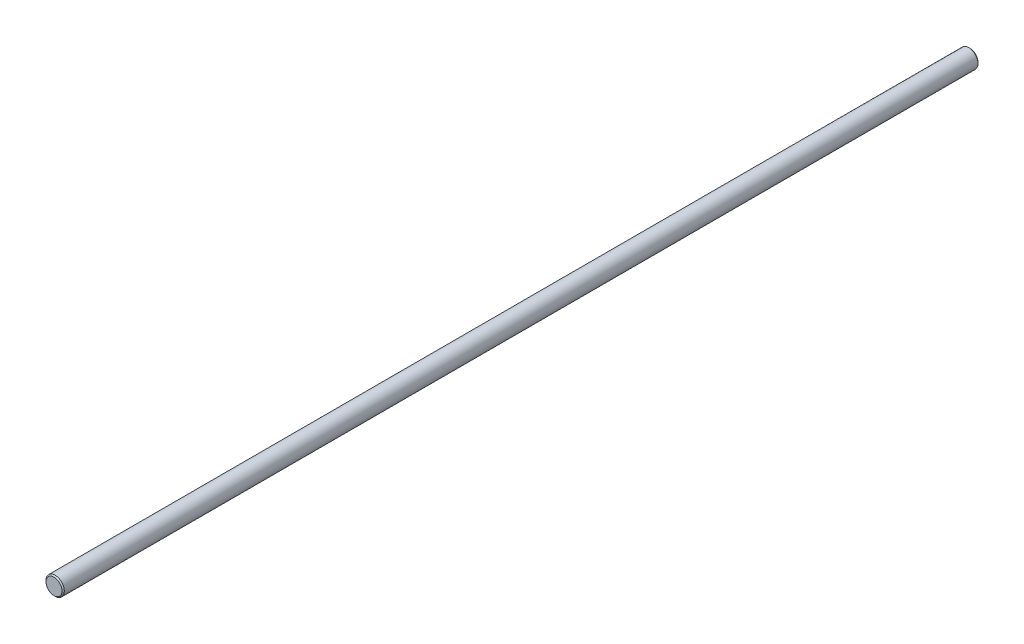
from build123d import *

# Parameters (mm, degrees)
SKETCH1_R      = 4
EXTRUDE1_DEPTH = 400
CHAMFER1_SIZE  = 0.5


with BuildPart() as part:
    # Sketch1 → Extrude1 (new body)
    with BuildSketch(Plane.XY):
        Circle(SKETCH1_R)
    extrude(amount=EXTRUDE1_DEPTH)

    # Chamfer1
    chamfer1_edges = [part.edges().sort_by_distance(p)[0] for p in [
        (-4, 0, 0),
        (-4, 0, 400),
    ]]
    chamfer(chamfer1_edges, length=CHAMFER1_SIZE)


solid = part.part
